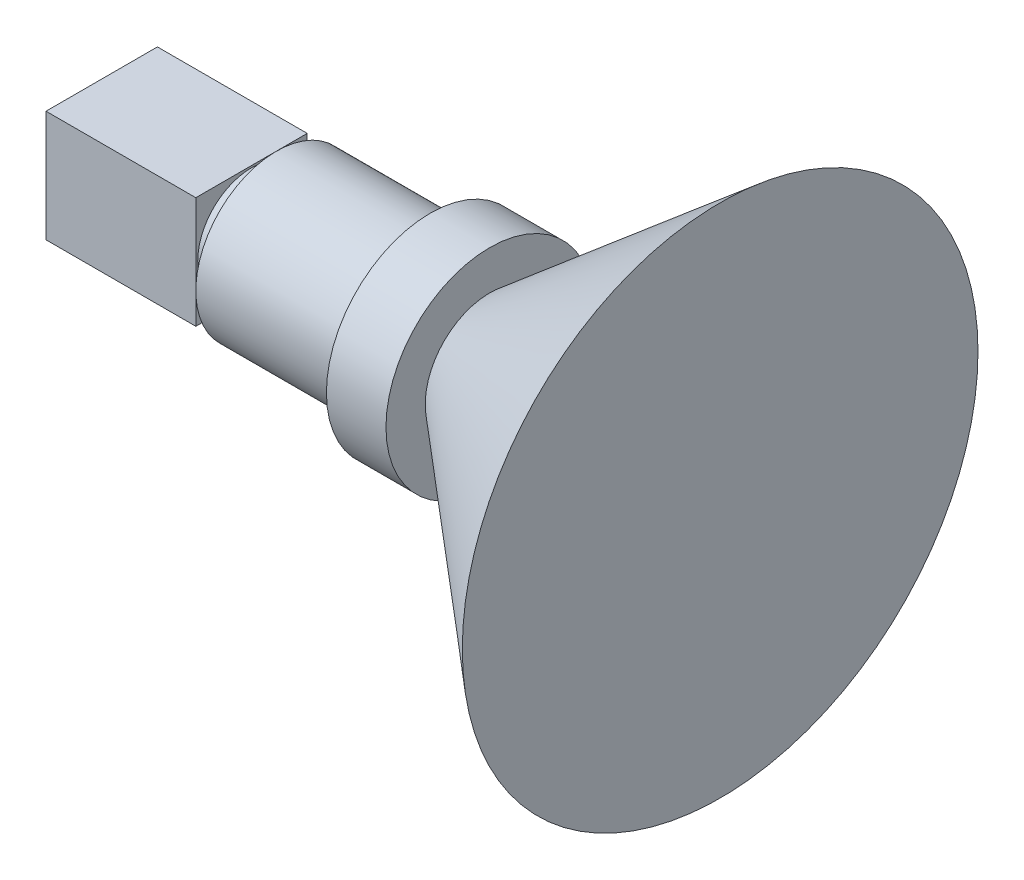
from build123d import *

# Parameters (mm, degrees)
SKETCH2_W                 = 39
SKETCH2_H                 = 29
BOSS_EXTRUDE1_DEPTH       = 14.5
SKETCH4_R                 = 14
BOSS_EXTRUDE2_DEPTH       = 6.5
SKETCH5_R                 = 21
BOSS_EXTRUDE3_DEPTH       = 40
SKETCH6_R                 = 27
BOSS_EXTRUDE4_DEPTH       = 15.5
M3X0_5_TAPPED_HOLE1_D     = 2.5
M3X0_5_TAPPED_HOLE1_DEPTH = 5
M3X0_5_TAPPED_HOLE1_TIP   = 0.751075774


with BuildPart() as part:
    # Sketch2 → Boss-Extrude1 (new, symmetric)
    with BuildSketch(Plane(origin=(0, 0, 0), x_dir=(1, 0, 0), z_dir=(0, 1, 0))):
        Rectangle(SKETCH2_W, SKETCH2_H)
    extrude(amount=BOSS_EXTRUDE1_DEPTH, both=True)

    # Sketch4 → Boss-Extrude2 (add)
    with BuildSketch(Plane(origin=(19.5, 0, 0), x_dir=(0, 0, -1), z_dir=(1, 0, 0))):
        with Locations(Location((0, 0, 0), (0, 0, 180))):
            Circle(SKETCH4_R)
    extrude(amount=BOSS_EXTRUDE2_DEPTH)

    # Sketch5 → Boss-Extrude3 (add)
    with BuildSketch(Plane(origin=(26, 0, 0), x_dir=(0, 0, -1), z_dir=(1, 0, 0))):
        Circle(SKETCH5_R)
    extrude(amount=BOSS_EXTRUDE3_DEPTH)

    # Sketch6 → Boss-Extrude4 (add)
    with BuildSketch(Plane(origin=(66, 0, 0), x_dir=(0, 0, -1), z_dir=(1, 0, 0))):
        Circle(SKETCH6_R)
    extrude(amount=BOSS_EXTRUDE4_DEPTH)

    # M3x0.5 Tapped Hole1
    with Locations(Plane(origin=(0, -14.5, 0), x_dir=(-1, 0, 0), z_dir=(0, -1, 0))):
        with Locations((-16.5, 11.5), (16.5, 11.5), (16.5, -11.5), (-16.5, -11.5)):
            Hole(M3X0_5_TAPPED_HOLE1_D / 2, depth=M3X0_5_TAPPED_HOLE1_DEPTH)
            with Locations((0, 0, -(M3X0_5_TAPPED_HOLE1_DEPTH + M3X0_5_TAPPED_HOLE1_TIP / 2))):  # 118° drill point
                Cone(0, M3X0_5_TAPPED_HOLE1_D / 2, M3X0_5_TAPPED_HOLE1_TIP, mode=Mode.SUBTRACT)

    # Sketch12 → Revolve1 (revolve)
    with BuildSketch(Plane.XY, mode=Mode.PRIVATE) as revolve1_sk:
        Polygon((61.5, 0), (141.5, 67.127970494), (141.5, 0), align=None)
    revolve(revolve1_sk.sketch.rotate(Axis((61.5, 0, 0), (1, 0, 0)), 270), axis=Axis((61.5, 0, 0), (1, 0, 0)))


solid = part.part
